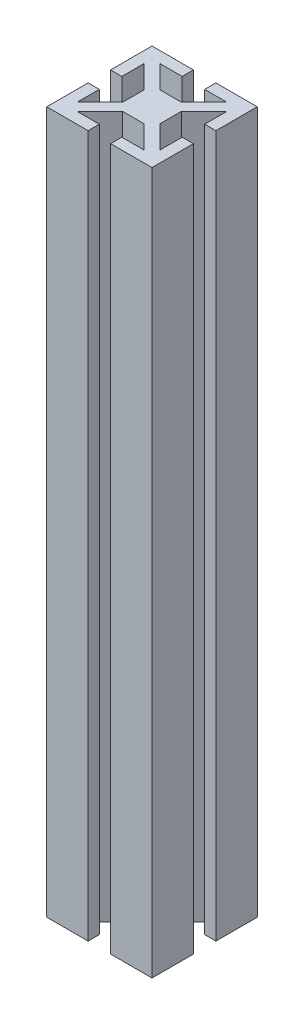
from build123d import *

# Parameters (mm, degrees)
BOSS_EXTRUDE1_DEPTH = 254


with BuildPart() as part:
    # Sketch2 → Boss-Extrude1 (new body)
    with BuildSketch(Plane(origin=(0, 0, 0), x_dir=(1, 0, 0), z_dir=(0, 1, 0))):
        Polygon((-19.05, 19.05), (-4.064, 19.05), (-4.064, 14.986), (-12.112318041, 14.986), (-3.882718041, 6.7564), (3.882718041, 6.7564), (12.112318041, 14.986), (4.064, 14.986), (4.064, 19.05), (19.05, 19.05), (19.05, 4.064), (14.986, 4.064), (14.986, 12.112318041), (6.7564, 3.882718041), (6.7564, -3.882718041), (14.986, -12.112318041), (14.986, -4.064), (19.05, -4.064), (19.05, -19.05), (4.064, -19.05), (4.064, -14.986), (12.112318041, -14.986), (3.882718041, -6.7564), (-3.882718041, -6.7564), (-12.112318041, -14.986), (-4.064, -14.986), (-4.064, -19.05), (-19.05, -19.05), (-19.05, -4.064), (-14.986, -4.064), (-14.986, -12.112318041), (-6.7564, -3.882718041), (-6.7564, 3.882718041), (-14.986, 12.112318041), (-14.986, 4.064), (-19.05, 4.064), align=None)
    extrude(amount=-BOSS_EXTRUDE1_DEPTH)


solid = part.part
